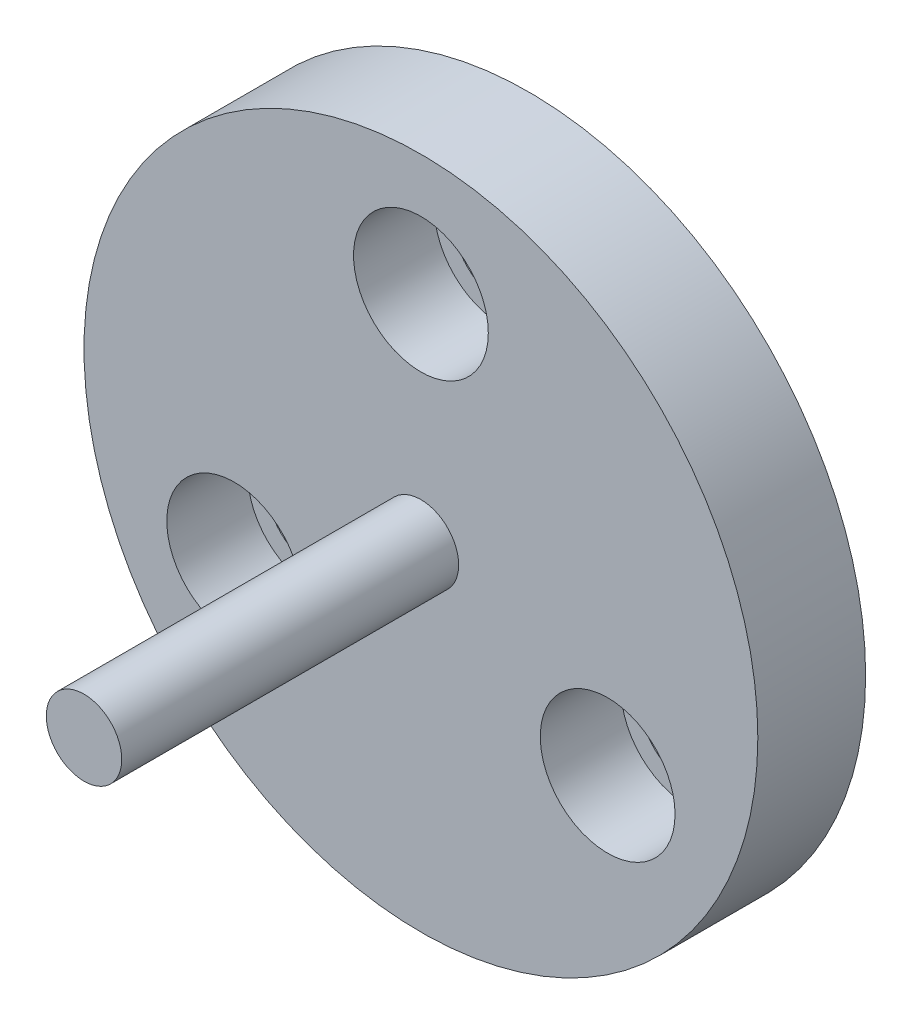
from build123d import *

# Parameters (mm, degrees)
SKETCH_1_R               = 3
SKETCH_1_R_2             = 1.65
EXTRUDE_1_DEPTH          = 4
CUT_EXTRUDE_2_DEPTH      = 6.830951895
PATTERN_CIRCULAR_1_COUNT = 9
SKETCH_2_R               = 5
EXTRUDE_2_DEPTH          = 4
SKETCH_3_R               = 12.5
SKETCH_3_R_2             = 1.8
SKETCH_3_R_3             = 5
EXTRUDE_4_DEPTH          = 4
CUT_EXTRUDE_START        = 4
SKETCH_3_3_R             = 2.5
CUT_EXTRUDE_3_DEPTH      = 3
SKETCH_4_R               = 1.4
EXTRUDE_5_DEPTH          = 12.5


with BuildPart() as part:
    # 草图1 → 凸台-拉伸1 (new body)
    with BuildSketch(Plane.XY):
        Circle(SKETCH_1_R)
        Circle(SKETCH_1_R_2, mode=Mode.SUBTRACT)
    extrude(amount=EXTRUDE_1_DEPTH)

    # 草图1<3> → 切除-拉伸2 (cut, through all)
    with BuildSketch(Plane.XY):
        with BuildLine():
            Line((1.583201231, 0.595370355), (1.54440693, 0.580781573))
            ThreePointArc((1.54440693, 0.580781573), (1.623387112, 0.295151288), (1.65, 0))
            ThreePointArc((1.65, 0), (1.623387112, -0.295151288), (1.54440693, -0.580781573))
            Line((1.54440693, -0.580781573), (1.583201231, -0.595370355))
            add(Edge.make_bspline(
                [(1.583201231, -0.595370355), (1.595268082, -0.599908151), (1.629927649, -0.609960022), (1.698544644, -0.618780808), (1.810680065, -0.617601716), (1.954246735, -0.59352555), (2.132298369, -0.536822163), (2.302941373, -0.452472776), (2.42578745, -0.372108406), (2.505673341, -0.310927028), (2.533645284, -0.288342805)],
                knots=[0, 0, 0, 0, 0, 0.005604068, 0.015718248, 0.029959916, 0.048733667, 0.068727063, 0.096888892, 0.112551479, 0.112551479, 0.112551479, 0.112551479, 0.112551479], degree=4))
            ThreePointArc((2.533645284, -0.288342805), (2.545908038, -0.144403125), (2.55, 0))
            ThreePointArc((2.55, 0), (2.545908038, 0.144403125), (2.533645284, 0.288342805))
            add(Edge.make_bspline(
                [(1.583201231, 0.595370355), (1.595268082, 0.599908151), (1.629927649, 0.609960022), (1.698544644, 0.618780808), (1.810680065, 0.617601716), (1.954246735, 0.59352555), (2.132298369, 0.536822163), (2.302941373, 0.452472776), (2.42578745, 0.372108406), (2.505673341, 0.310927028), (2.533645284, 0.288342805)],
                knots=[0, 0, 0, 0, 0, 0.005604068, 0.015718248, 0.029959916, 0.048733667, 0.068727063, 0.096888892, 0.112551479, 0.112551479, 0.112551479, 0.112551479, 0.112551479], degree=4))
        make_face()
    cut_extrude_2 = extrude(amount=CUT_EXTRUDE_2_DEPTH, mode=Mode.SUBTRACT)

    # 阵列(圆周)1: 切除-拉伸2 ×9 about axis
    pattern_circular_1_axis = Axis((0, 0, 4), (0, 0, 1))
    for i in range(1, PATTERN_CIRCULAR_1_COUNT):
        add(cut_extrude_2.rotate(pattern_circular_1_axis, i * 360 / PATTERN_CIRCULAR_1_COUNT), mode=Mode.SUBTRACT)

    # 草图2 → 凸台-拉伸2 (add)
    with BuildSketch(Plane(origin=(0, 0, 0), x_dir=(-1, 0, 0), z_dir=(0, 0, -1))):
        Circle(SKETCH_2_R)
    extrude(amount=-EXTRUDE_2_DEPTH)

    # 草图3 → 凸台-拉伸4 (add)
    with BuildSketch(Plane.XY):
        Circle(SKETCH_3_R)
        with Locations((0, 8)):
            Circle(SKETCH_3_R_2, mode=Mode.SUBTRACT)
        with Locations((6.92820323, -4)):
            Circle(SKETCH_3_R_2, mode=Mode.SUBTRACT)
        with Locations((-6.92820323, -4)):
            Circle(SKETCH_3_R_2, mode=Mode.SUBTRACT)
        Circle(SKETCH_3_R_3, mode=Mode.SUBTRACT)
    extrude(amount=EXTRUDE_4_DEPTH)

    # 草图3<3> → 切除-拉伸3 (cut)
    with BuildSketch(Plane.XY.offset(CUT_EXTRUDE_START)):
        with Locations((0, 8)):
            Circle(SKETCH_3_3_R)
        with Locations((6.92820323, -4)):
            Circle(SKETCH_3_3_R)
        with Locations((-6.92820323, -4)):
            Circle(SKETCH_3_3_R)
    extrude(amount=-CUT_EXTRUDE_3_DEPTH, mode=Mode.SUBTRACT)

    # 草图4 → 凸台-拉伸5 (add)
    with BuildSketch(Plane.XY.offset(4)):
        Circle(SKETCH_4_R)
    extrude(amount=EXTRUDE_5_DEPTH)


solid = part.part
